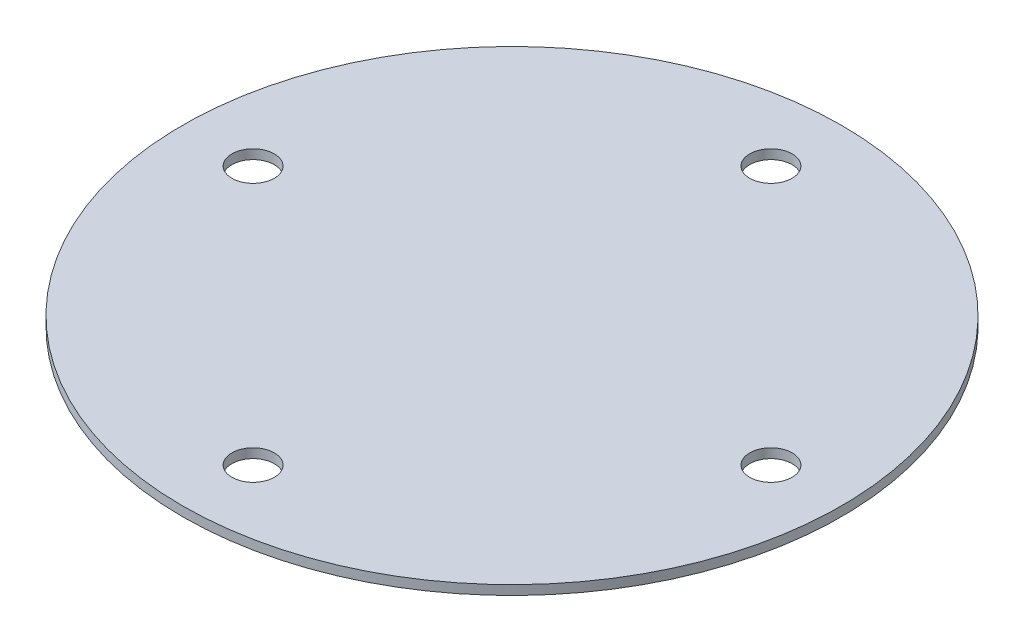
from build123d import *

# Parameters (mm, degrees)
SKETCH1_R           = 35
SKETCH1_R_2         = 20
BOSS_EXTRUDE1_DEPTH = 1
SKETCH3_R           = 20
BOSS_EXTRUDE2_DEPTH = 1
CUT_EXTRUDE1_REACH  = 51.508
SKETCH4_R           = 2.25


with BuildPart() as part:
    # Sketch1 → Boss-Extrude1 (new body)
    with BuildSketch(Plane(origin=(0, 0, 0), x_dir=(1, 0, 0), z_dir=(0, 1, 0))):
        with Locations(Location((0, 0, 0), (0, 0, 270))):
            Circle(SKETCH1_R)
        with Locations(Location((0, 0, 0), (0, 0, 270))):
            Circle(SKETCH1_R_2, mode=Mode.SUBTRACT)
    extrude(amount=BOSS_EXTRUDE1_DEPTH)

    # Sketch3 → Boss-Extrude2 (add)
    with BuildSketch(Plane(origin=(0, 0, 0), x_dir=(1, 0, 0), z_dir=(0, 1, 0))):
        Circle(SKETCH3_R)
    extrude(amount=BOSS_EXTRUDE2_DEPTH)

    # Sketch4 → Cut-Extrude1 (cut, up to next)
    with BuildSketch(Plane(origin=(0, 1, 0), x_dir=(1, 0, 0), z_dir=(0, 1, 0)), mode=Mode.PRIVATE) as cut_extrude1_sk1:
        with Locations(Location((0, 27.5, 0), (0, 0, 270))):
            Circle(SKETCH4_R)
    cut_extrude1_tool1 = extrude(cut_extrude1_sk1.sketch, amount=-CUT_EXTRUDE1_REACH, mode=Mode.PRIVATE) & part.part
    # Sketch4 → Cut-Extrude1 (cut, up to next)
    with BuildSketch(Plane(origin=(0, 1, 0), x_dir=(1, 0, 0), z_dir=(0, 1, 0)), mode=Mode.PRIVATE) as cut_extrude1_sk2:
        with Locations(Location((27.5, 0, 0), (0, 0, 270))):
            Circle(SKETCH4_R)
    cut_extrude1_tool2 = extrude(cut_extrude1_sk2.sketch, amount=-CUT_EXTRUDE1_REACH, mode=Mode.PRIVATE) & part.part
    # Sketch4 → Cut-Extrude1 (cut, up to next)
    with BuildSketch(Plane(origin=(0, 1, 0), x_dir=(1, 0, 0), z_dir=(0, 1, 0)), mode=Mode.PRIVATE) as cut_extrude1_sk3:
        with Locations(Location((0, -27.5, 0), (0, 0, 270))):
            Circle(SKETCH4_R)
    cut_extrude1_tool3 = extrude(cut_extrude1_sk3.sketch, amount=-CUT_EXTRUDE1_REACH, mode=Mode.PRIVATE) & part.part
    # Sketch4 → Cut-Extrude1 (cut, up to next)
    with BuildSketch(Plane(origin=(0, 1, 0), x_dir=(1, 0, 0), z_dir=(0, 1, 0)), mode=Mode.PRIVATE) as cut_extrude1_sk4:
        with Locations(Location((-27.5, 0, 0), (0, 0, 270))):
            Circle(SKETCH4_R)
    cut_extrude1_tool4 = extrude(cut_extrude1_sk4.sketch, amount=-CUT_EXTRUDE1_REACH, mode=Mode.PRIVATE) & part.part
    add(cut_extrude1_tool1.solids().sort_by_distance((0, 1, -27.5))[0], mode=Mode.SUBTRACT)
    add(cut_extrude1_tool2.solids().sort_by_distance((27.5, 1, 0))[0], mode=Mode.SUBTRACT)
    add(cut_extrude1_tool3.solids().sort_by_distance((0, 1, 27.5))[0], mode=Mode.SUBTRACT)
    add(cut_extrude1_tool4.solids().sort_by_distance((-27.5, 1, 0))[0], mode=Mode.SUBTRACT)


solid = part.part
